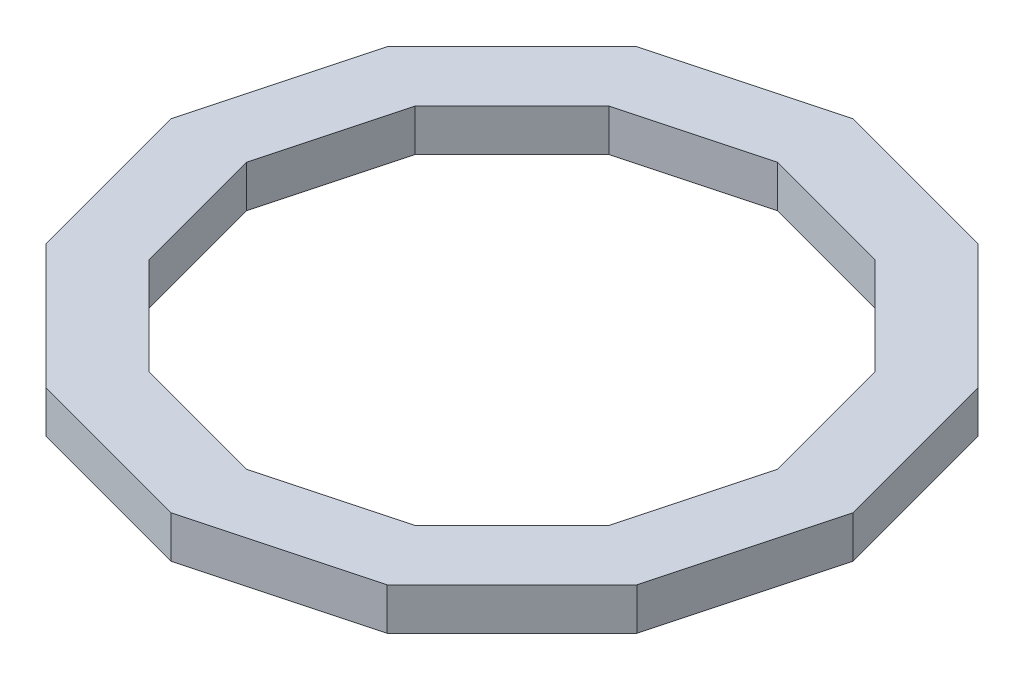
from build123d import *

# Parameters (mm, degrees)
BOSS_EXTRUDE2_DEPTH = 19.05


with BuildPart() as part:
    # Sketch2 → Boss-Extrude2 (new body)
    with BuildSketch(Plane(origin=(0, 0, 0), x_dir=(1, 0, 0), z_dir=(0, 1, 0))):
        Polygon((-154.567450723, 0), (-133.859338924, -77.283725361), (-77.283725361, -133.859338924), (0, -154.567450723), (77.283725361, -133.859338924), (133.859338924, -77.283725361), (154.567450723, 0), (133.859338924, 77.283725361), (77.283725361, 133.859338924), (0, 154.567450723), (-77.283725361, 133.859338924), (-133.859338924, 77.283725361), align=None)
        Polygon((-120.382631246, 0), (-104.254416833, -60.191315623), (-60.191315623, -104.254416833), (0, -120.382631246), (60.191315623, -104.254416833), (104.254416833, -60.191315623), (120.382631246, 0), (104.254416833, 60.191315623), (60.191315623, 104.254416833), (0, 120.382631246), (-60.191315623, 104.254416833), (-104.254416833, 60.191315623), align=None, mode=Mode.SUBTRACT)
    extrude(amount=BOSS_EXTRUDE2_DEPTH)


solid = part.part
